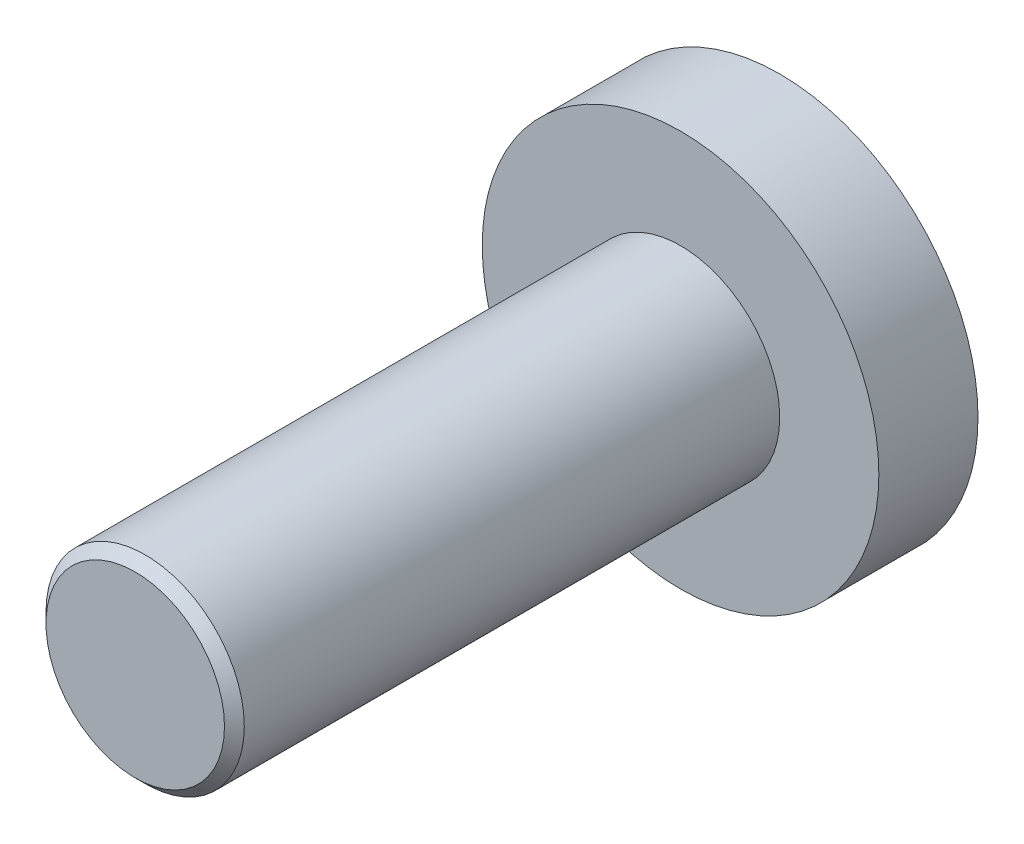
from build123d import *

# Parameters (mm, degrees)
SKETCH_1_R      = 2
EXTRUDE_1_DEPTH = 11
SKETCH_2_R      = 4
EXTRUDE_2_DEPTH = 2
CHAMFER_1_SIZE  = 0.2


with BuildPart() as part:
    # 草图1 → 拉伸1 (new body)
    with BuildSketch(Plane.XY):
        Circle(SKETCH_1_R)
    extrude(amount=EXTRUDE_1_DEPTH)

    # 草图2 → 拉伸2 (add)
    with BuildSketch(Plane(origin=(0, 0, 0), x_dir=(-1, 0, 0), z_dir=(0, 0, -1))):
        Circle(SKETCH_2_R)
    extrude(amount=EXTRUDE_2_DEPTH)

    # 倒角1
    chamfer_1_edges = [part.edges().sort_by_distance(p)[0] for p in [
        (-2, 0, 11),
    ]]
    chamfer(chamfer_1_edges, length=CHAMFER_1_SIZE)


solid = part.part
